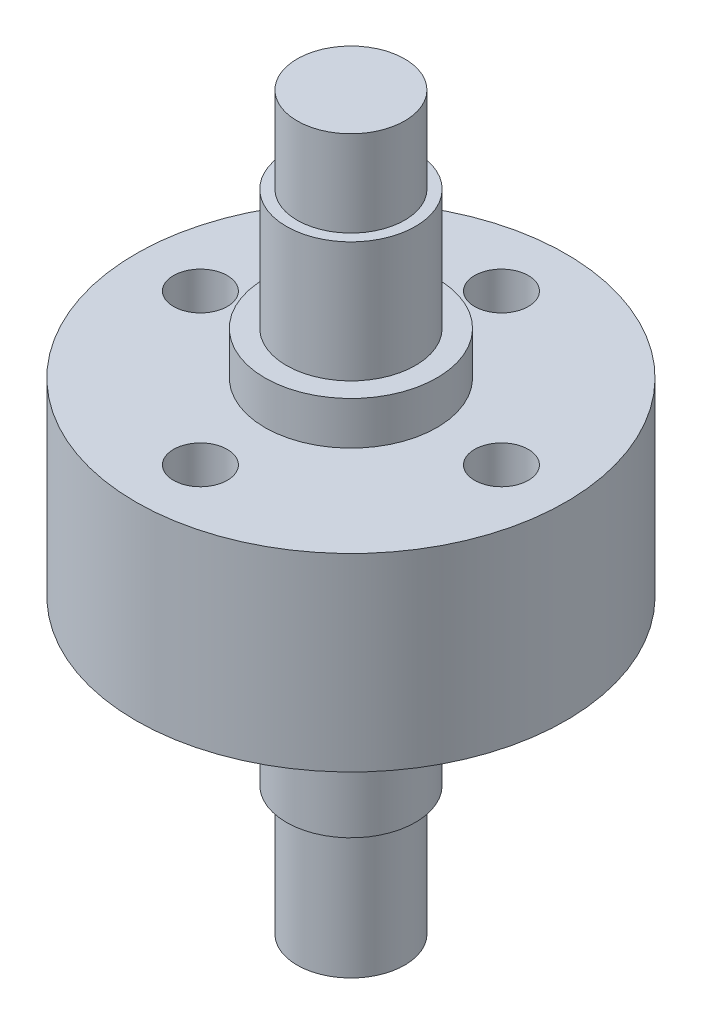
from build123d import *

# Parameters (mm, degrees)
HOLE_WIZARD_M3_1_D       = 2.5
PATTERN_CIRCULAR_1_COUNT = 4


with BuildPart() as part:
    # Model → 旋转1 (revolve)
    with BuildSketch(Plane.XY, mode=Mode.PRIVATE) as revolve_1_sk:
        Polygon((-1.786351506, 28.377960803), (-1.786351506, -5.622039197), (0.713648494, -5.622039197), (0.713648494, 0.377960803), (1.213648494, 0.377960803), (1.213648494, 5.977960803), (2.213648494, 5.977960803), (2.213648494, 7.977960803), (8.213648494, 7.977960803), (8.213648494, 16.777960803), (2.213648494, 16.777960803), (2.213648494, 18.777960803), (1.213648494, 18.777960803), (1.213648494, 24.377960803), (0.713648494, 24.377960803), (0.713648494, 28.377960803), align=None)
    revolve(revolve_1_sk.sketch.rotate(Axis((-1.786351506, 28.377960803, 0), (0, -1, 0)), 90), axis=Axis((-1.786351506, 28.377960803, 0), (0, -1, 0)))

    # M3 螺纹孔1 (through all)
    with Locations(Plane(origin=(-1.786351506, 7.977960803, 7), x_dir=(0, 0, -1), z_dir=(0, -1, 0))):
        with Locations((0, 0)):
            hole_wizard_m3_1 = Hole(HOLE_WIZARD_M3_1_D / 2)

    # 阵列(圆周)1: M3 螺纹孔1 ×4 about axis
    pattern_circular_1_axis = Axis((-1.786351506, 0, 0), (0, 1, 0))
    for i in range(1, PATTERN_CIRCULAR_1_COUNT):
        add(hole_wizard_m3_1.rotate(pattern_circular_1_axis, i * 360 / PATTERN_CIRCULAR_1_COUNT), mode=Mode.SUBTRACT)


solid = part.part
